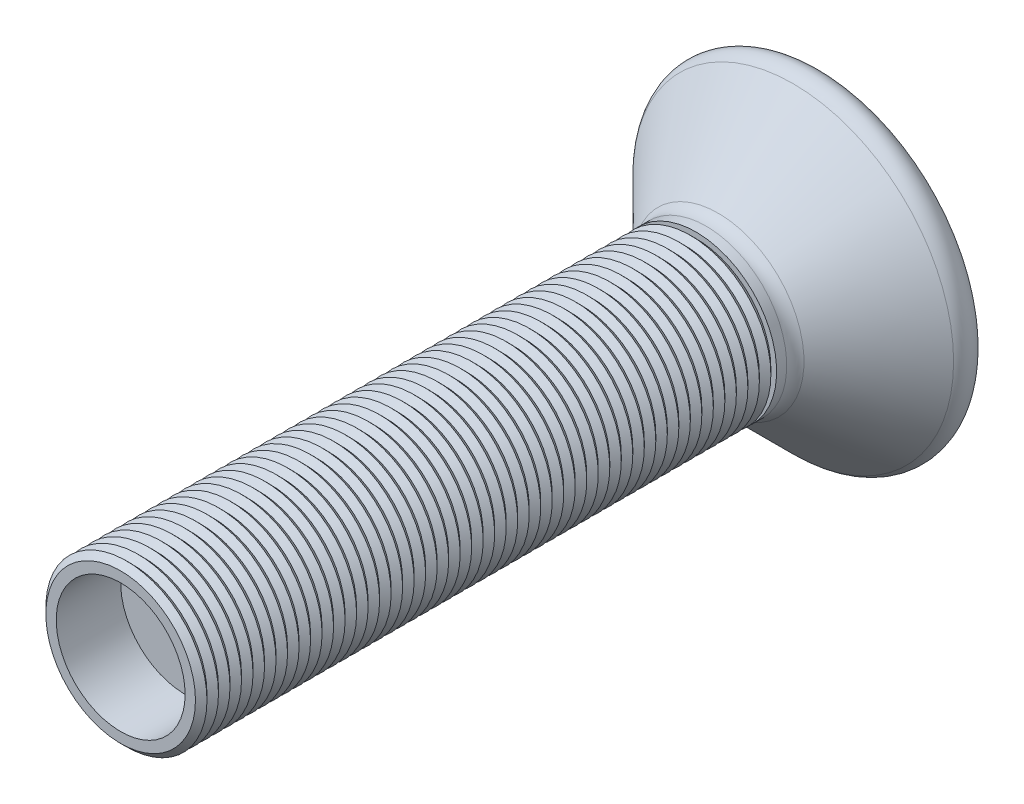
from build123d import *

# Parameters (mm, degrees)
CROQUIS2_R              = 13
SALIENTE_EXTRUIR1_DEPTH = 100
REDONDEO1_R             = 3
CROQUIS8_R              = 11.2
CORTAR_EXTRUIR1_DEPTH   = 11.2
CORTAR_EXTRUIR2_START   = -11.2
CROQUIS9_R              = 11.2
CORTAR_EXTRUIR2_DEPTH   = 11.2
CORTAR_EXTRUIR3_REACH   = 120.028
CROQUIS10_R             = 4.5


with BuildPart() as part:
    # Croquis1 → Revolución1 (revolve)
    with BuildSketch(Plane.XZ, mode=Mode.PRIVATE) as revoluci_n1_sk:
        Polygon((14, 22), (0, 22), (0, 0), (33, 0), (14, 19), align=None)
    revolve(revoluci_n1_sk.sketch.rotate(Axis((0, 0, 22), (0, 0, -1)), 180), axis=Axis((0, 0, 22), (0, 0, -1)))

    # Croquis2 → Saliente-Extruir1 (add)
    with BuildSketch(Plane.XY.offset(22)):
        Circle(CROQUIS2_R)
    extrude(amount=SALIENTE_EXTRUIR1_DEPTH)

    # Redondeo1
    redondeo1_edges = [part.edges().sort_by_distance(p)[0] for p in [
        (14, 0, 19),
        (33, 0, 0),
    ]]
    fillet(redondeo1_edges, radius=REDONDEO1_R)

    # Croquis6 → Revolución2 (revolve)
    with BuildSketch(Plane(origin=(0, 0, 0), x_dir=(0, 0, -1), z_dir=(1, 0, 0)), mode=Mode.PRIVATE) as revoluci_n2_sk:
        Polygon((-70, 13), (-68, 13), (-69, 14), align=None)
        Polygon((-32, 13), (-30, 13), (-31, 14), align=None)
        Polygon((-23, 14), (-24, 13), (-22, 13), align=None)
        Polygon((-25, 14), (-26, 13), (-24, 13), align=None)
        Polygon((-27, 14), (-28, 13), (-26, 13), align=None)
        Polygon((-29, 14), (-30, 13), (-28, 13), align=None)
        Polygon((-31, 14), (-32, 13), (-30, 13), align=None)
        Polygon((-33, 14), (-34, 13), (-32, 13), align=None)
        Polygon((-35, 14), (-36, 13), (-34, 13), align=None)
        Polygon((-37, 14), (-38, 13), (-36, 13), align=None)
        Polygon((-105, 14), (-106, 13), (-104, 13), align=None)
        Polygon((-115, 14), (-116, 13), (-114, 13), align=None)
        Polygon((-117, 14), (-118, 13), (-116, 13), align=None)
        Polygon((-40, 13), (-38, 13), (-39, 14), align=None)
        Polygon((-41, 14), (-40, 13), (-42, 13), align=None)
        Polygon((-44, 13), (-42, 13), (-43, 14), align=None)
        Polygon((-45, 14), (-44, 13), (-46, 13), align=None)
        Polygon((-48, 13), (-46, 13), (-47, 14), align=None)
        Polygon((-50, 13), (-48, 13), (-49, 14), align=None)
        Polygon((-51, 14), (-50, 13), (-52, 13), align=None)
        Polygon((-53, 14), (-54, 13), (-52, 13), align=None)
        Polygon((-56, 13), (-54, 13), (-55, 14), align=None)
        Polygon((-58, 13), (-56, 13), (-57, 14), align=None)
        Polygon((-60, 13), (-58, 13), (-59, 14), align=None)
        Polygon((-62, 13), (-60, 13), (-61, 14), align=None)
        Polygon((-64, 13), (-62, 13), (-63, 14), align=None)
        Polygon((-66, 13), (-64, 13), (-65, 14), align=None)
        Polygon((-67, 14), (-68, 13), (-66, 13), align=None)
        Polygon((-71, 14), (-72, 13), (-70, 13), align=None)
        Polygon((-74, 13), (-72, 13), (-73, 14), align=None)
        Polygon((-75, 14), (-74, 13), (-76, 13), align=None)
        Polygon((-78, 13), (-76, 13), (-77, 14), align=None)
        Polygon((-80, 13), (-78, 13), (-79, 14), align=None)
        Polygon((-81, 14), (-80, 13), (-82, 13), align=None)
        Polygon((-83, 14), (-84, 13), (-82, 13), align=None)
        Polygon((-85, 14), (-86, 13), (-84, 13), align=None)
        Polygon((-87, 14), (-86, 13), (-88, 13), align=None)
        Polygon((-89, 14), (-90, 13), (-88, 13), align=None)
        Polygon((-92, 13), (-90, 13), (-91, 14), align=None)
        Polygon((-94, 13), (-92, 13), (-93, 14), align=None)
        Polygon((-96, 13), (-94, 13), (-95, 14), align=None)
        Polygon((-98, 13), (-96, 13), (-97, 14), align=None)
        Polygon((-100, 13), (-98, 13), (-99, 14), align=None)
        Polygon((-102, 13), (-100, 13), (-101, 14), align=None)
        Polygon((-104, 13), (-102, 13), (-103, 14), align=None)
        Polygon((-107, 14), (-106, 13), (-108, 13), align=None)
        Polygon((-110, 13), (-108, 13), (-109, 14), align=None)
        Polygon((-112, 13), (-110, 13), (-111, 14), align=None)
        Polygon((-113, 14), (-112, 13), (-114, 13), align=None)
        Polygon((-120, 13), (-118, 13), (-119, 14), align=None)
        Polygon((-122, 13), (-120, 13), (-121, 14), align=None)
    revolve(revoluci_n2_sk.sketch.rotate(Axis((0, 0, 122), (0, 0, -1)), 90), axis=Axis((0, 0, 122), (0, 0, -1)))

    # Croquis8 → Cortar-Extruir1 (cut)
    with BuildSketch(Plane.XY.offset(122)):
        Circle(CROQUIS8_R)
    extrude(amount=-CORTAR_EXTRUIR1_DEPTH, mode=Mode.SUBTRACT)

    # Croquis9 → Cortar-Extruir2 (cut)
    with BuildSketch(Plane(origin=(0, 0, 0), x_dir=(-1, 0, 0), z_dir=(0, 0, -1)).offset(CORTAR_EXTRUIR2_START)):
        with Locations(Location((0, 0, 0), (0, 0, 180))):
            Circle(CROQUIS9_R)
    extrude(amount=CORTAR_EXTRUIR2_DEPTH, mode=Mode.SUBTRACT)

    # Croquis10 → Cortar-Extruir3 (cut, up to next)
    with BuildSketch(Plane(origin=(0, 0, 11.2), x_dir=(-1, 0, 0), z_dir=(0, 0, -1)), mode=Mode.PRIVATE) as cortar_extruir3_sk1:
        Circle(CROQUIS10_R)
    cortar_extruir3_tool1 = extrude(cortar_extruir3_sk1.sketch, amount=-CORTAR_EXTRUIR3_REACH, mode=Mode.PRIVATE) & part.part
    add(cortar_extruir3_tool1.solids().sort_by_distance((0, 0, 11.2))[0], mode=Mode.SUBTRACT)


solid = part.part
